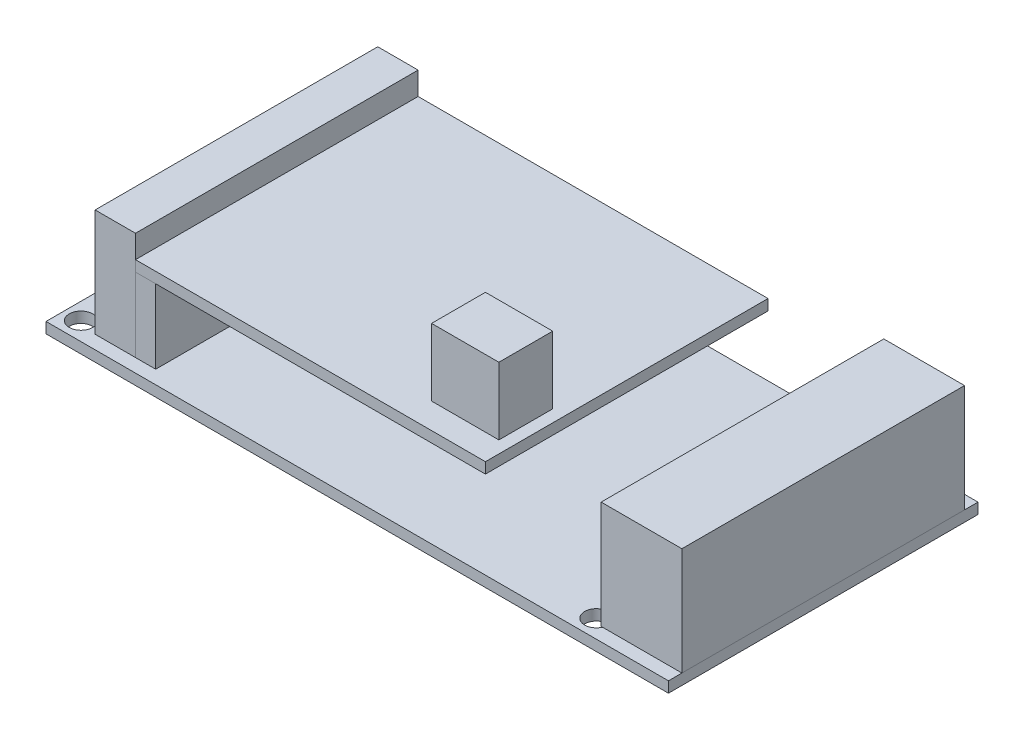
from build123d import *

# Parameters (mm, degrees)
SKICA1_W                  = 92.5
SKICA1_H                  = 46
P_IDAT_VYSUNUT_M1_DEPTH   = 1.6
F_3_5_3_5_PR_M_R_D_RY1_D  = 3.5
SKICA4_W                  = 6
SKICA4_H                  = 42
P_IDAT_VYSUNUT_M2_DEPTH   = 16
SKICA4_W_2                = 12
P_IDAT_VYSUNUT_M2_2_DEPTH = 16
SKICA5_W                  = 3
SKICA5_H                  = 42
P_IDAT_VYSUNUT_M3_DEPTH   = 11
SKICA6_W                  = 52
SKICA6_H                  = 42
P_IDAT_VYSUNUT_M4_DEPTH   = 1.6
SKICA7_W                  = 10
SKICA7_H                  = 8
P_IDAT_VYSUNUT_M5_DEPTH   = 10


with BuildPart() as part:
    # Skica1 → Přidat vysunutím1 (new body)
    with BuildSketch(Plane(origin=(0, 0, 0), x_dir=(1, 0, 0), z_dir=(0, 1, 0))):
        Rectangle(SKICA1_W, SKICA1_H)
    extrude(amount=P_IDAT_VYSUNUT_M1_DEPTH)

    # Ø3.5 (3.5) průměr díry1 (through all)
    with Locations(Plane(origin=(0, 1.6, 0), x_dir=(1, 0, 0), z_dir=(0, 1, 0))):
        with Locations((-43.75, 20.3), (-43.75, -20.3), (32.85, -20.3), (32.85, 20.3)):
            Hole(F_3_5_3_5_PR_M_R_D_RY1_D / 2)


with BuildPart() as body_2:
    # Skica4 → Přidat vysunutím2 (new body)
    with BuildSketch(Plane(origin=(0, 1.6, 0), x_dir=(1, 0, 0), z_dir=(0, 1, 0))):
        with Locations((-37.95, 0)):
            Rectangle(SKICA4_W, SKICA4_H)
    extrude(amount=P_IDAT_VYSUNUT_M2_DEPTH)


with BuildPart() as body_3:
    # Skica4 → P_idat vysunut_m2 2 (new body)
    with BuildSketch(Plane(origin=(0, 1.6, 0), x_dir=(1, 0, 0), z_dir=(0, 1, 0))):
        with Locations((40.25, 0)):
            Rectangle(SKICA4_W_2, SKICA4_H)
    extrude(amount=P_IDAT_VYSUNUT_M2_2_DEPTH)


with BuildPart() as body_4:
    # Skica5 → Přidat vysunutím3 (new body)
    with BuildSketch(Plane(origin=(0, 1.6, 0), x_dir=(1, 0, 0), z_dir=(0, 1, 0))):
        with Locations((-33.45, 0)):
            Rectangle(SKICA5_W, SKICA5_H)
    extrude(amount=P_IDAT_VYSUNUT_M3_DEPTH)


with BuildPart() as body_5:
    # Skica6 → Přidat vysunutím4 (new body)
    with BuildSketch(Plane(origin=(0, 12.6, 0), x_dir=(1, 0, 0), z_dir=(0, 1, 0))):
        with Locations((-8.95, 0)):
            Rectangle(SKICA6_W, SKICA6_H)
    extrude(amount=P_IDAT_VYSUNUT_M4_DEPTH)


with BuildPart() as body_6:
    # Skica7 → Přidat vysunutím5 (new body)
    with BuildSketch(Plane(origin=(0, 14.2, 0), x_dir=(1, 0, 0), z_dir=(0, 1, 0))):
        with Locations((10.25, -13.2)):
            Rectangle(SKICA7_W, SKICA7_H)
    extrude(amount=P_IDAT_VYSUNUT_M5_DEPTH)


solid = Compound([part.part, body_2.part, body_3.part, body_4.part, body_5.part, body_6.part])
